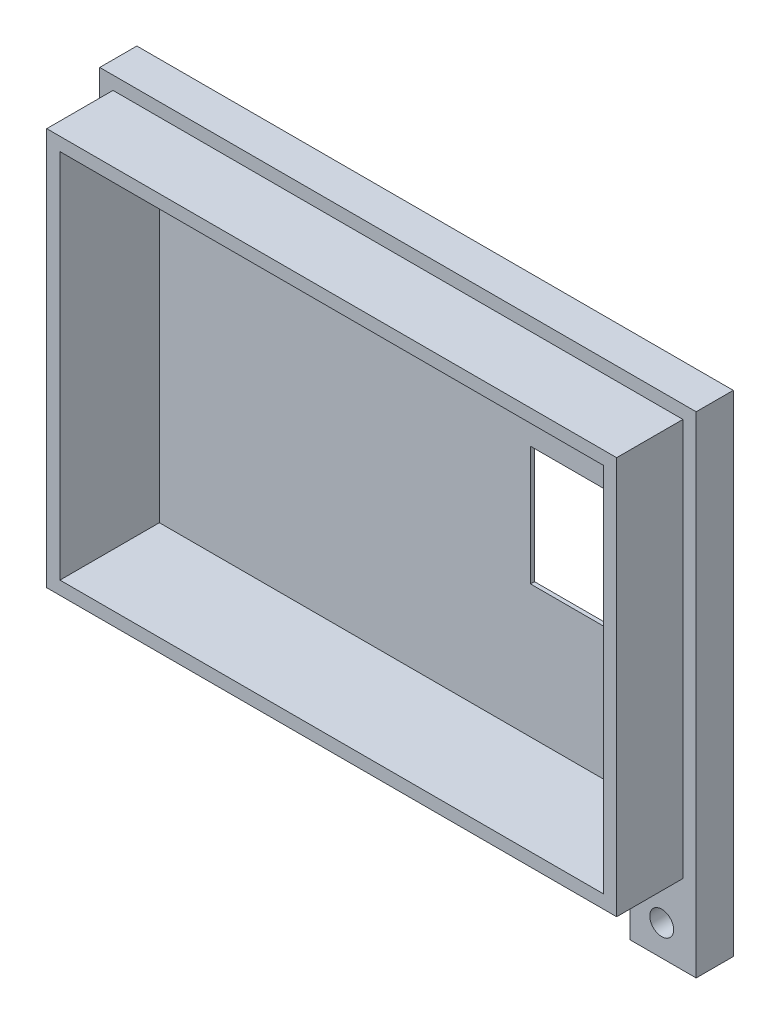
from build123d import *

# Parameters (mm, degrees)
ESQUISSE1_W             = 45
ESQUISSE1_H             = 32
BOSS_EXTRU_1_DEPTH      = 7.8
ESQUISSE2_W             = 41
ESQUISSE2_H             = 28
ENL_V_MAT_EXTRU_1_DEPTH = 7.5
ESQUISSE4_OUTSIDE_W     = 58.154
ESQUISSE4_OUTSIDE_H     = 45.154
ESQUISSE4_OUTSIDE_W_2   = 43
ESQUISSE4_OUTSIDE_H_2   = 30
ENL_V_MAT_EXTRU_2_DEPTH = 5
ESQUISSE5_W             = 9
ESQUISSE5_H             = 9
ENL_V_MAT_EXTRU_3_DEPTH = 5
ESQUISSE6_W             = 5
ESQUISSE6_H             = 5
BOSS_EXTRU_2_DEPTH      = 2.8


with BuildPart() as part:
    # Esquisse1 → Boss.-Extru.1 (new body)
    with BuildSketch(Plane.XY):
        with Locations((7.42437914, -4.08326268)):
            Rectangle(ESQUISSE1_W, ESQUISSE1_H)
    extrude(amount=BOSS_EXTRU_1_DEPTH)

    # Esquisse2 → Enlèv. mat.-Extru.1 (cut)
    with BuildSketch(Plane.XY.offset(7.8)):
        with Locations((7.42437914, -4.08326268)):
            Rectangle(ESQUISSE2_W, ESQUISSE2_H)
    extrude(amount=-ENL_V_MAT_EXTRU_1_DEPTH, mode=Mode.SUBTRACT)

    # Esquisse4 outside → Enlèv. mat.-Extru.2 (cut)
    with BuildSketch(Plane.XY.offset(7.8)):
        with Locations((7.424, -4.083)):
            Rectangle(ESQUISSE4_OUTSIDE_W, ESQUISSE4_OUTSIDE_H)
        with Locations((7.42437914, -4.08326268)):
            Rectangle(ESQUISSE4_OUTSIDE_W_2, ESQUISSE4_OUTSIDE_H_2, mode=Mode.SUBTRACT)
    extrude(amount=-ENL_V_MAT_EXTRU_2_DEPTH, mode=Mode.SUBTRACT)

    # Esquisse5 → Enlèv. mat.-Extru.3 (cut)
    with BuildSketch(Plane(origin=(0, 0, 0), x_dir=(-1, 0, 0), z_dir=(0, 0, -1))):
        with Locations((-19.42437914, -3.58326268)):
            Rectangle(ESQUISSE5_W, ESQUISSE5_H)
    extrude(amount=-ENL_V_MAT_EXTRU_3_DEPTH, mode=Mode.SUBTRACT)

    # Esquisse6 → Boss.-Extru.2 (add)
    with BuildSketch(Plane(origin=(0, 0, 0), x_dir=(-1, 0, 0), z_dir=(0, 0, -1))):
        with Locations((-27.42437914, -22.58326268)):
            Rectangle(ESQUISSE6_W, ESQUISSE6_H)
    extrude(amount=-BOSS_EXTRU_2_DEPTH)

    # Esquisse7 → Chambrage pour vis à tête ronde bombée M1.61 (revolve, cut)
    with BuildSketch(Plane(origin=(27.324958559, -22.78326268, 0), x_dir=(0, 1, 0), z_dir=(1, 0, 0))):
        Polygon((0, 0), (0, 7.790774557), (0.9, 7.25), (0.9, 1.3), (1.75, 1.3), (1.75, 0.025), (1.775, 0), align=None)
    revolve(axis=Axis((27.324958559, -22.78326268, -6.35), (0, 0, 1)), mode=Mode.SUBTRACT)


solid = part.part
